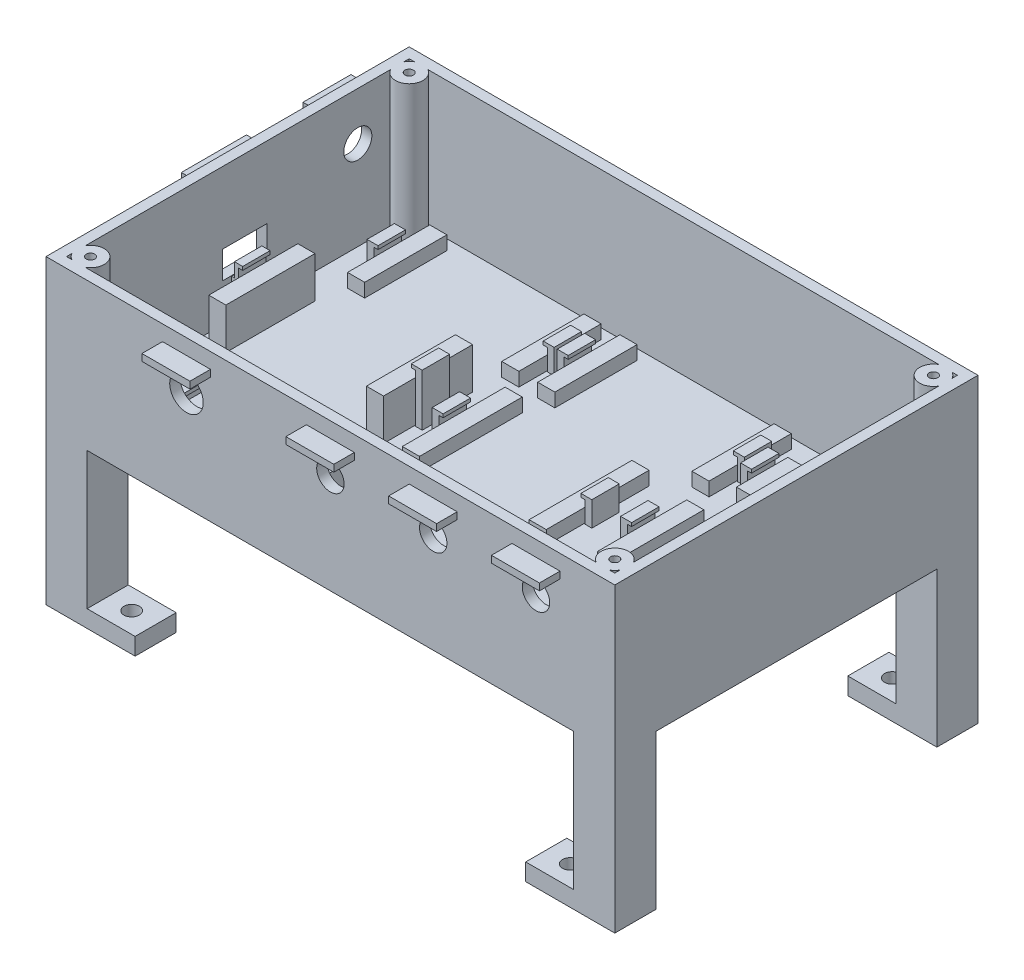
from build123d import *

# Parameters (mm, degrees)
BOX_SHELL_START          = 45
SKETCH1_W                = 166
SKETCH1_H                = 106
BOX_SHELL_DEPTH          = 43
BOX_CAVITY_START         = 88
SKETCH2_W                = 160
SKETCH2_H                = 100
BOX_CAVITY_DEPTH         = 40
LID_BOSSES_START         = 48
SKETCH3_R                = 4
LID_BOSSES_DEPTH         = 40
LID_SCREW_HOLES_M3_START = 88
SKETCH4_R                = 1.25
LID_SCREW_HOLES_M3_DEPTH = 12
SKETCH5_W                = 12
SKETCH5_H                = 12
LEGS_DEPTH               = 45
SKETCH6_W                = 26
SKETCH6_H                = 12
LEG_PADS_DEPTH           = 5
LEG_HOLES_M4_START       = -0.5
SKETCH7_R                = 2.25
LEG_HOLES_M4_DEPTH       = 6
BOARD_PADS_4MM_START     = 48
SKETCH8_W                = 5
SKETCH8_H                = 30
SKETCH8_H_2              = 26
SKETCH8_H_3              = 24
SKETCH8_H_4              = 15
SKETCH8_H_5              = 28
BOARD_PADS_4MM_DEPTH     = 4
BOARD_CLIPS_4MM_START    = 48
SKETCH9_W                = 2
SKETCH9_H                = 8
BOARD_CLIPS_4MM_DEPTH    = 7.2
CLIP_LIPS_4MM_START      = 54.2
SKETCH10_W               = 1.2
SKETCH10_H               = 8
CLIP_LIPS_4MM_DEPTH      = 1
BOARD_PADS_12MM_START    = 48
SKETCH11_W               = 5
SKETCH11_H               = 26
BOARD_PADS_12MM_DEPTH    = 12
BOARD_CLIPS_12MM_START   = 48
SKETCH12_W               = 2
SKETCH12_H               = 8
BOARD_CLIPS_12MM_DEPTH   = 15.2
CLIP_LIPS_12MM_START     = 62.2
SKETCH13_W               = 1.2
SKETCH13_H               = 8
CLIP_LIPS_12MM_DEPTH     = 1
FRONT_WALL_HOLES_START   = 49
SKETCH14_R               = 4.9
SKETCH14_R_2             = 4
FRONT_WALL_HOLES_DEPTH   = 5
FRONT_DRIP_LIPS_START    = 81.5
SKETCH15_W               = 14
SKETCH15_H               = 6
FRONT_DRIP_LIPS_DEPTH    = 2
LEFT_WALL_HOLES_START    = -84
SKETCH16_R               = 4.1
SKETCH16_W               = 13
SKETCH16_H               = 8
LEFT_WALL_HOLES_DEPTH    = 5
LEFT_DRIP_LIPS_START     = 81.5
SKETCH17_W               = 6
SKETCH17_H               = 14
SKETCH17_H_2             = 19
LEFT_DRIP_LIPS_DEPTH     = 2


with BuildPart() as part:
    # Sketch1 → Box_Shell (new body)
    with BuildSketch(Plane(origin=(0, 0, 0), x_dir=(1, 0, 0), z_dir=(0, 1, 0)).offset(BOX_SHELL_START)):
        Rectangle(SKETCH1_W, SKETCH1_H)
    extrude(amount=BOX_SHELL_DEPTH)

    # Sketch2 → Box_Cavity (cut)
    with BuildSketch(Plane(origin=(0, 0, 0), x_dir=(1, 0, 0), z_dir=(0, 1, 0)).offset(BOX_CAVITY_START)):
        Rectangle(SKETCH2_W, SKETCH2_H)
    extrude(amount=-BOX_CAVITY_DEPTH, mode=Mode.SUBTRACT)

    # Sketch3 → Lid_Bosses (add)
    with BuildSketch(Plane(origin=(0, 0, 0), x_dir=(1, 0, 0), z_dir=(0, 1, 0)).offset(LID_BOSSES_START)):
        with Locations((-76.5, 46.5)):
            Circle(SKETCH3_R)
        with Locations((-76.5, -46.5)):
            Circle(SKETCH3_R)
        with Locations((76.5, 46.5)):
            Circle(SKETCH3_R)
        with Locations((76.5, -46.5)):
            Circle(SKETCH3_R)
    extrude(amount=LID_BOSSES_DEPTH)

    # Sketch4 → Lid_Screw_Holes_M3 (cut)
    with BuildSketch(Plane(origin=(0, 0, 0), x_dir=(1, 0, 0), z_dir=(0, 1, 0)).offset(LID_SCREW_HOLES_M3_START)):
        with Locations(Location((-76.5, 46.5, 0), (0, 0, 270))):
            Circle(SKETCH4_R)
        with Locations(Location((-76.5, -46.5, 0), (0, 0, 270))):
            Circle(SKETCH4_R)
        with Locations(Location((76.5, 46.5, 0), (0, 0, 270))):
            Circle(SKETCH4_R)
        with Locations(Location((76.5, -46.5, 0), (0, 0, 270))):
            Circle(SKETCH4_R)
    extrude(amount=-LID_SCREW_HOLES_M3_DEPTH, mode=Mode.SUBTRACT)

    # Sketch5 → Legs (add)
    with BuildSketch(Plane(origin=(0, 0, 0), x_dir=(1, 0, 0), z_dir=(0, 1, 0))):
        with Locations((-77, 47)):
            Rectangle(SKETCH5_W, SKETCH5_H)
        with Locations((-77, -47)):
            Rectangle(SKETCH5_W, SKETCH5_H)
        with Locations((77, 47)):
            Rectangle(SKETCH5_W, SKETCH5_H)
        with Locations((77, -47)):
            Rectangle(SKETCH5_W, SKETCH5_H)
    extrude(amount=LEGS_DEPTH)

    # Sketch6 → Leg_Pads (add)
    with BuildSketch(Plane(origin=(0, 0, 0), x_dir=(1, 0, 0), z_dir=(0, 1, 0))):
        with Locations((-70, 47)):
            Rectangle(SKETCH6_W, SKETCH6_H)
        with Locations((-70, -47)):
            Rectangle(SKETCH6_W, SKETCH6_H)
        with Locations((70, 47)):
            Rectangle(SKETCH6_W, SKETCH6_H)
        with Locations((70, -47)):
            Rectangle(SKETCH6_W, SKETCH6_H)
    extrude(amount=LEG_PADS_DEPTH)

    # Sketch7 → Leg_Holes_M4 (cut)
    with BuildSketch(Plane(origin=(0, 0, 0), x_dir=(1, 0, 0), z_dir=(0, 1, 0)).offset(LEG_HOLES_M4_START)):
        with Locations(Location((-64, 47, 0), (0, 0, 270))):
            Circle(SKETCH7_R)
        with Locations(Location((-64, -47, 0), (0, 0, 270))):
            Circle(SKETCH7_R)
        with Locations(Location((64, 47, 0), (0, 0, 270))):
            Circle(SKETCH7_R)
        with Locations(Location((64, -47, 0), (0, 0, 270))):
            Circle(SKETCH7_R)
    extrude(amount=LEG_HOLES_M4_DEPTH, mode=Mode.SUBTRACT)

    # Sketch8 → Board_Pads_4mm (add)
    with BuildSketch(Plane(origin=(0, 0, 0), x_dir=(1, 0, 0), z_dir=(0, 1, 0)).offset(BOARD_PADS_4MM_START)):
        with Locations((-16.5, 2)):
            Rectangle(SKETCH8_W, SKETCH8_H)
        with Locations((20.5, 2)):
            Rectangle(SKETCH8_W, SKETCH8_H)
        with Locations((38.5, 2)):
            Rectangle(SKETCH8_W, SKETCH8_H_2)
        with Locations((71.5, 2)):
            Rectangle(SKETCH8_W, SKETCH8_H_2)
        with Locations((-68.5, 35)):
            Rectangle(SKETCH8_W, SKETCH8_H_3)
        with Locations((-23.5, 35)):
            Rectangle(SKETCH8_W, SKETCH8_H_3)
        with Locations((-13, 35)):
            Rectangle(SKETCH8_W, SKETCH8_H_3)
        with Locations((32, 35)):
            Rectangle(SKETCH8_W, SKETCH8_H_3)
        with Locations((42.5, 33)):
            Rectangle(SKETCH8_W, SKETCH8_H_4)
        with Locations((71.5, 33)):
            Rectangle(SKETCH8_W, SKETCH8_H_4)
        with Locations((-59.5, -32)):
            Rectangle(SKETCH8_W, SKETCH8_H_5)
        with Locations((-24.5, -32)):
            Rectangle(SKETCH8_W, SKETCH8_H_5)
    extrude(amount=BOARD_PADS_4MM_DEPTH)

    # Sketch9 → Board_Clips_4mm (add)
    with BuildSketch(Plane(origin=(0, 0, 0), x_dir=(1, 0, 0), z_dir=(0, 1, 0)).offset(BOARD_CLIPS_4MM_START)):
        with Locations((-20.3, 2)):
            Rectangle(SKETCH9_W, SKETCH9_H)
        with Locations((24.3, 2)):
            Rectangle(SKETCH9_W, SKETCH9_H)
        with Locations((34.7, 2)):
            Rectangle(SKETCH9_W, SKETCH9_H)
        with Locations((75.3, 2)):
            Rectangle(SKETCH9_W, SKETCH9_H)
        with Locations((-72.3, 35)):
            Rectangle(SKETCH9_W, SKETCH9_H)
        with Locations((-19.7, 35)):
            Rectangle(SKETCH9_W, SKETCH9_H)
        with Locations((-16.8, 35)):
            Rectangle(SKETCH9_W, SKETCH9_H)
        with Locations((35.8, 35)):
            Rectangle(SKETCH9_W, SKETCH9_H)
        with Locations((38.7, 33)):
            Rectangle(SKETCH9_W, SKETCH9_H)
        with Locations((75.3, 33)):
            Rectangle(SKETCH9_W, SKETCH9_H)
        with Locations((-63.3, -32)):
            Rectangle(SKETCH9_W, SKETCH9_H)
        with Locations((-20.7, -32)):
            Rectangle(SKETCH9_W, SKETCH9_H)
    extrude(amount=BOARD_CLIPS_4MM_DEPTH)

    # Sketch10 → Clip_Lips_4mm (add)
    with BuildSketch(Plane(origin=(0, 0, 0), x_dir=(1, 0, 0), z_dir=(0, 1, 0)).offset(CLIP_LIPS_4MM_START)):
        with Locations((-18.7, 2)):
            Rectangle(SKETCH10_W, SKETCH10_H)
        with Locations((22.7, 2)):
            Rectangle(SKETCH10_W, SKETCH10_H)
        with Locations((36.3, 2)):
            Rectangle(SKETCH10_W, SKETCH10_H)
        with Locations((73.7, 2)):
            Rectangle(SKETCH10_W, SKETCH10_H)
        with Locations((-70.7, 35)):
            Rectangle(SKETCH10_W, SKETCH10_H)
        with Locations((-21.3, 35)):
            Rectangle(SKETCH10_W, SKETCH10_H)
        with Locations((-15.2, 35)):
            Rectangle(SKETCH10_W, SKETCH10_H)
        with Locations((34.2, 35)):
            Rectangle(SKETCH10_W, SKETCH10_H)
        with Locations((40.3, 33)):
            Rectangle(SKETCH10_W, SKETCH10_H)
        with Locations((73.7, 33)):
            Rectangle(SKETCH10_W, SKETCH10_H)
        with Locations((-61.7, -32)):
            Rectangle(SKETCH10_W, SKETCH10_H)
        with Locations((-22.3, -32)):
            Rectangle(SKETCH10_W, SKETCH10_H)
    extrude(amount=CLIP_LIPS_4MM_DEPTH)

    # Sketch11 → Board_Pads_12mm (add)
    with BuildSketch(Plane(origin=(0, 0, 0), x_dir=(1, 0, 0), z_dir=(0, 1, 0)).offset(BOARD_PADS_12MM_START)):
        with Locations((-75, 2)):
            Rectangle(SKETCH11_W, SKETCH11_H)
        with Locations((-29, 2)):
            Rectangle(SKETCH11_W, SKETCH11_H)
    extrude(amount=BOARD_PADS_12MM_DEPTH)

    # Sketch12 → Board_Clips_12mm (add)
    with BuildSketch(Plane(origin=(0, 0, 0), x_dir=(1, 0, 0), z_dir=(0, 1, 0)).offset(BOARD_CLIPS_12MM_START)):
        with Locations((-78.8, 2)):
            Rectangle(SKETCH12_W, SKETCH12_H)
        with Locations((-25.2, 2)):
            Rectangle(SKETCH12_W, SKETCH12_H)
    extrude(amount=BOARD_CLIPS_12MM_DEPTH)

    # Sketch13 → Clip_Lips_12mm (add)
    with BuildSketch(Plane(origin=(0, 0, 0), x_dir=(1, 0, 0), z_dir=(0, 1, 0)).offset(CLIP_LIPS_12MM_START)):
        with Locations((-77.2, 2)):
            Rectangle(SKETCH13_W, SKETCH13_H)
        with Locations((-26.8, 2)):
            Rectangle(SKETCH13_W, SKETCH13_H)
    extrude(amount=CLIP_LIPS_12MM_DEPTH)

    # Sketch14 → Front_Wall_Holes (cut)
    with BuildSketch(Plane.XY.offset(FRONT_WALL_HOLES_START)):
        with Locations(Location((-42, 74, 0), (0, 0, 180))):
            Circle(SKETCH14_R)
        with Locations(Location((0, 74, 0), (0, 0, 180))):
            Circle(SKETCH14_R_2)
        with Locations(Location((30, 74, 0), (0, 0, 180))):
            Circle(SKETCH14_R_2)
        with Locations(Location((60, 74, 0), (0, 0, 180))):
            Circle(SKETCH14_R_2)
    extrude(amount=FRONT_WALL_HOLES_DEPTH, mode=Mode.SUBTRACT)

    # Sketch15 → Front_Drip_Lips (add)
    with BuildSketch(Plane(origin=(0, 0, 0), x_dir=(1, 0, 0), z_dir=(0, 1, 0)).offset(FRONT_DRIP_LIPS_START)):
        with Locations((-42, -56)):
            Rectangle(SKETCH15_W, SKETCH15_H)
        with Locations((0, -56)):
            Rectangle(SKETCH15_W, SKETCH15_H)
        with Locations((30, -56)):
            Rectangle(SKETCH15_W, SKETCH15_H)
        with Locations((60, -56)):
            Rectangle(SKETCH15_W, SKETCH15_H)
    extrude(amount=FRONT_DRIP_LIPS_DEPTH)

    # Sketch16 → Left_Wall_Holes (cut)
    with BuildSketch(Plane(origin=(0, 0, 0), x_dir=(0, 0, -1), z_dir=(1, 0, 0)).offset(LEFT_WALL_HOLES_START)):
        with Locations(Location((35, 74, 0), (0, 0, 180))):
            Circle(SKETCH16_R)
        with Locations((2, 63.1)):
            Rectangle(SKETCH16_W, SKETCH16_H)
    extrude(amount=LEFT_WALL_HOLES_DEPTH, mode=Mode.SUBTRACT)

    # Sketch17 → Left_Drip_Lips (add)
    with BuildSketch(Plane(origin=(0, 0, 0), x_dir=(1, 0, 0), z_dir=(0, 1, 0)).offset(LEFT_DRIP_LIPS_START)):
        with Locations((-86, 35)):
            Rectangle(SKETCH17_W, SKETCH17_H)
        with Locations((-86, 2)):
            Rectangle(SKETCH17_W, SKETCH17_H_2)
    extrude(amount=LEFT_DRIP_LIPS_DEPTH)


solid = part.part
